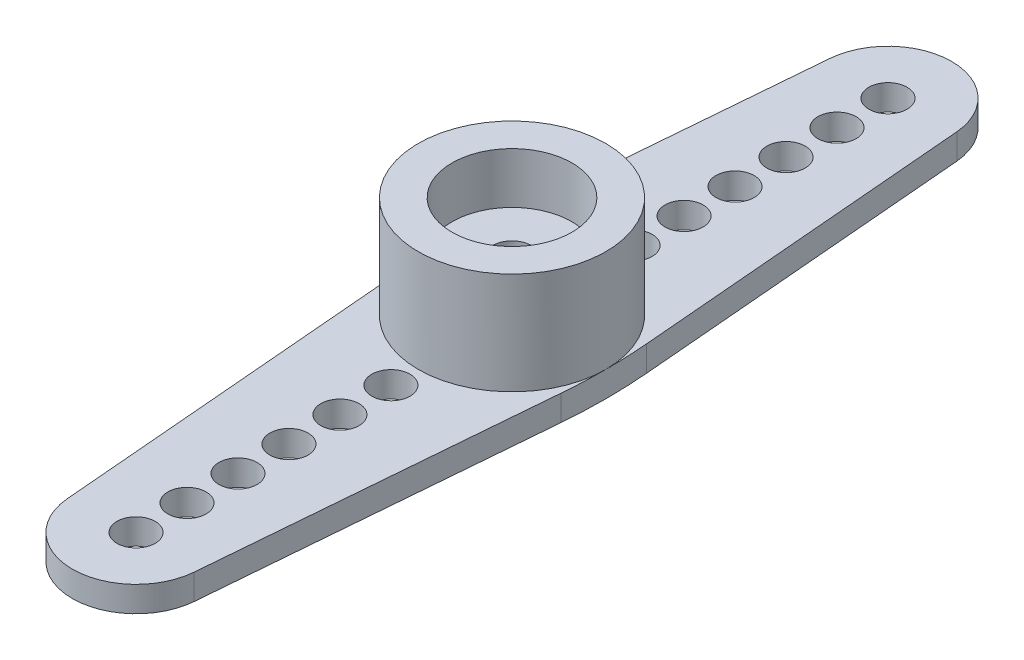
from build123d import *

# Parameters (mm, degrees)
SKETCH1_R           = 0.75
BOSS_EXTRUDE1_DEPTH = 1
SKETCH2_R           = 3.67931812
BOSS_EXTRUDE2_DEPTH = 5
SKETCH2_3_R         = 1.5
CUT_EXTRUDE1_DEPTH  = 0.5
SKETCH1_2_R         = 0.75
CUT_EXTRUDE2_DEPTH  = 19.333027078
SKETCH3_R           = 2.355
CUT_EXTRUDE3_DEPTH  = 2


with BuildPart() as part:
    # Sketch1 → Boss-Extrude1 (new body)
    with BuildSketch(Plane(origin=(0, 0, 0), x_dir=(1, 0, 0), z_dir=(0, 1, 0))):
        with BuildLine():
            Line((-2.49119588, 14.959626071), (-3.608885156, 1.677008569))
            ThreePointArc((-3.608885156, 1.677008569), (-3.67931812, 0), (-3.608885156, -1.677008569))
            Line((-3.608885156, -1.677008569), (-2.49119588, -14.959626071))
            ThreePointArc((-2.49119588, -14.959626071), (0, -17.25), (2.49119588, -14.959626071))
            Line((2.49119588, -14.959626071), (3.608885156, -1.677008569))
            ThreePointArc((3.608885156, -1.677008569), (3.67931812, 0), (3.608885156, 1.677008569))
            Line((3.608885156, 1.677008569), (2.49119588, 14.959626071))
            ThreePointArc((2.49119588, 14.959626071), (0, 17.25), (-2.49119588, 14.959626071))
        make_face()
        with Locations((0, 14.75)):
            Circle(SKETCH1_R, mode=Mode.SUBTRACT)
        with Locations((0, 12.75)):
            Circle(SKETCH1_R, mode=Mode.SUBTRACT)
        with Locations((0, 10.75)):
            Circle(SKETCH1_R, mode=Mode.SUBTRACT)
        with Locations((0, 8.75)):
            Circle(SKETCH1_R, mode=Mode.SUBTRACT)
        with Locations((0, 6.75)):
            Circle(SKETCH1_R, mode=Mode.SUBTRACT)
        with Locations((0, 4.75)):
            Circle(SKETCH1_R, mode=Mode.SUBTRACT)
        Circle(SKETCH1_R, mode=Mode.SUBTRACT)
        with Locations((0, -4.75)):
            Circle(SKETCH1_R, mode=Mode.SUBTRACT)
        with Locations((0, -6.75)):
            Circle(SKETCH1_R, mode=Mode.SUBTRACT)
        with Locations((0, -8.75)):
            Circle(SKETCH1_R, mode=Mode.SUBTRACT)
        with Locations((0, -10.75)):
            Circle(SKETCH1_R, mode=Mode.SUBTRACT)
        with Locations((0, -12.75)):
            Circle(SKETCH1_R, mode=Mode.SUBTRACT)
        with Locations((0, -14.75)):
            Circle(SKETCH1_R, mode=Mode.SUBTRACT)
    extrude(amount=BOSS_EXTRUDE1_DEPTH)

    # Sketch2 → Boss-Extrude2 (add)
    with BuildSketch(Plane.XZ):
        Circle(SKETCH2_R)
    extrude(amount=-BOSS_EXTRUDE2_DEPTH)

    # Sketch2<3> → Cut-Extrude1 (cut)
    with BuildSketch(Plane.XZ):
        Circle(SKETCH2_3_R)
    extrude(amount=-CUT_EXTRUDE1_DEPTH, mode=Mode.SUBTRACT)

    # Sketch1<2> → Cut-Extrude2 (cut, through all)
    with BuildSketch(Plane(origin=(0, 0, 0), x_dir=(1, 0, 0), z_dir=(0, 1, 0))):
        Circle(SKETCH1_2_R)
    extrude(amount=CUT_EXTRUDE2_DEPTH, mode=Mode.SUBTRACT)

    # Sketch3 → Cut-Extrude3 (cut)
    with BuildSketch(Plane(origin=(0, 5, 0), x_dir=(1, 0, 0), z_dir=(0, 1, 0))):
        Circle(SKETCH3_R)
    extrude(amount=-CUT_EXTRUDE3_DEPTH, mode=Mode.SUBTRACT)


solid = part.part
